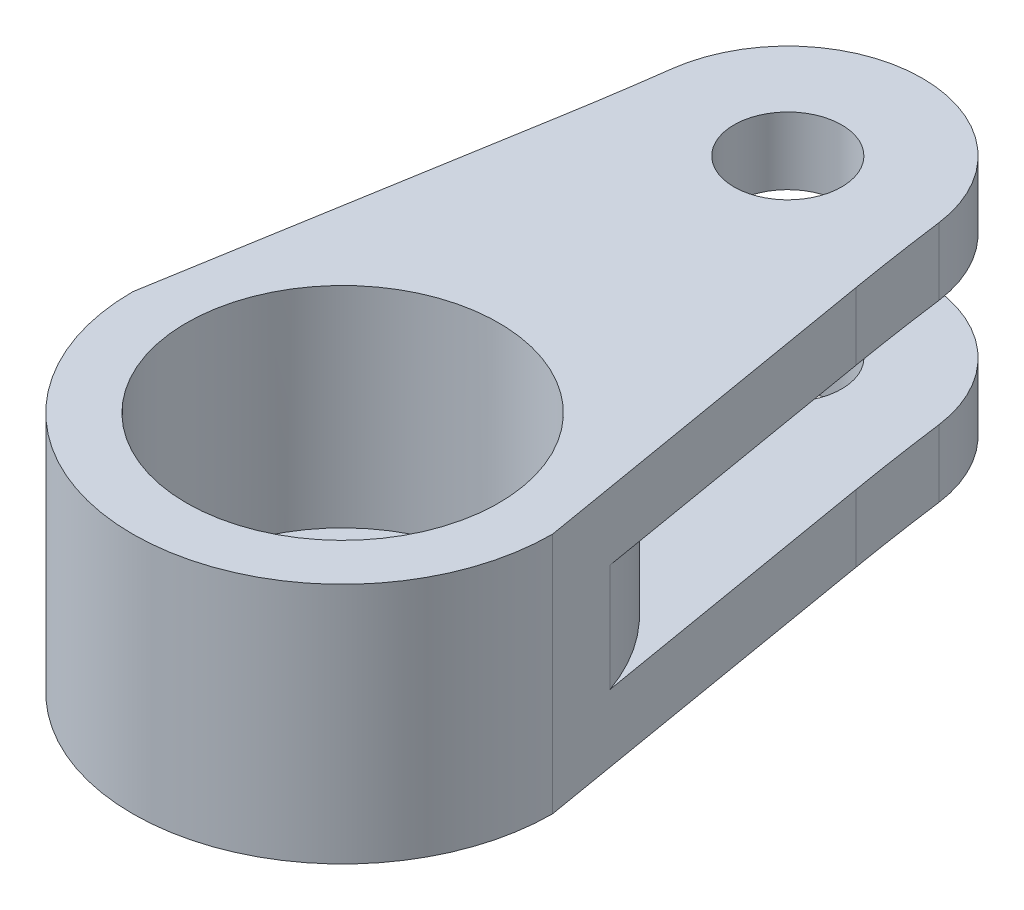
from build123d import *

# Parameters (mm, degrees)
SALIENTE_EXTRUIR1_DEPTH = 4.5
CROQUIS3_R              = 2.9
CROQUIS3_R_2            = 1
CORTAR_EXTRUIR1_DEPTH   = 13.30662017
REDONDEO1_R             = 50
CORTAR_EXTRUIR2_START   = -2.25
CROQUIS9_R              = 1
CORTAR_EXTRUIR2_DEPTH   = 1
SALIENTE_EXTRUIR2_START = -0.6
CROQUIS7_R              = 2.9
CROQUIS7_R_2            = 1.5
SALIENTE_EXTRUIR2_DEPTH = 0.6


with BuildPart() as part:
    # Croquis1 → Saliente-Extruir1 (new body)
    with BuildSketch(Plane(origin=(0, 0, 0), x_dir=(1, 0, 0), z_dir=(0, 1, 0))):
        with BuildLine():
            Line((-3.9, 0), (-2.5, 8.27))
            ThreePointArc((-2.5, 8.27), (0, 10.77), (2.5, 8.27))
            Line((2.5, 8.27), (3.9, 0))
            ThreePointArc((3.9, 0), (0, -3.9), (-3.9, 0))
        make_face()
    extrude(amount=SALIENTE_EXTRUIR1_DEPTH)

    # Croquis3 → Cortar-Extruir1 (cut, through all)
    with BuildSketch(Plane(origin=(0, 4.5, 0), x_dir=(1, 0, 0), z_dir=(0, 1, 0))):
        with Locations(Location((0, 0, 0), (0, 0, 270))):
            Circle(CROQUIS3_R)
        with Locations(Location((0, 8.27, 0), (0, 0, 270))):
            Circle(CROQUIS3_R_2)
    extrude(amount=-CORTAR_EXTRUIR1_DEPTH, mode=Mode.SUBTRACT)

    # Redondeo1
    redondeo1_edges = [part.edges().sort_by_distance(p)[0] for p in [
        (-2.5, 2.25, -8.27),
        (2.5, 2.25, -8.27),
    ]]
    fillet(redondeo1_edges, radius=REDONDEO1_R)

    # Croquis9 → Cortar-Extruir2 (cut, symmetric)
    with BuildSketch(Plane(origin=(0, 4.5, 0), x_dir=(1, 0, 0), z_dir=(0, 1, 0)).offset(CORTAR_EXTRUIR2_START)):
        with BuildLine():
            Line((3.682695525, 1.283648577), (2.750594125, 6.789704705))
            ThreePointArc((2.750594125, 6.789704705), (2.606305638, 7.69206861), (2.478532652, 8.596918789))
            ThreePointArc((2.478532652, 8.596918789), (0, 10.77), (-2.478532652, 8.596918789))
            ThreePointArc((-2.478532652, 8.596918789), (-2.606305638, 7.69206861), (-2.750594125, 6.789704705))
            Line((-2.750594125, 6.789704705), (-3.682695525, 1.283648577))
            ThreePointArc((-3.682695525, 1.283648577), (0, 3.9), (3.682695525, 1.283648577))
        make_face()
        with Locations(Location((0, 8.27, 0), (0, 0, 270))):
            Circle(CROQUIS9_R, mode=Mode.SUBTRACT)
    extrude(amount=CORTAR_EXTRUIR2_DEPTH, both=True, mode=Mode.SUBTRACT)

    # Croquis7 → Saliente-Extruir2 (add)
    with BuildSketch(Plane.XZ.offset(SALIENTE_EXTRUIR2_START)):
        with Locations(Location((0, 0, 0), (0, 0, 90))):
            Circle(CROQUIS7_R)
        with Locations(Location((0, 0, 0), (0, 0, 270))):
            Circle(CROQUIS7_R_2, mode=Mode.SUBTRACT)
    extrude(amount=SALIENTE_EXTRUIR2_DEPTH)


solid = part.part
